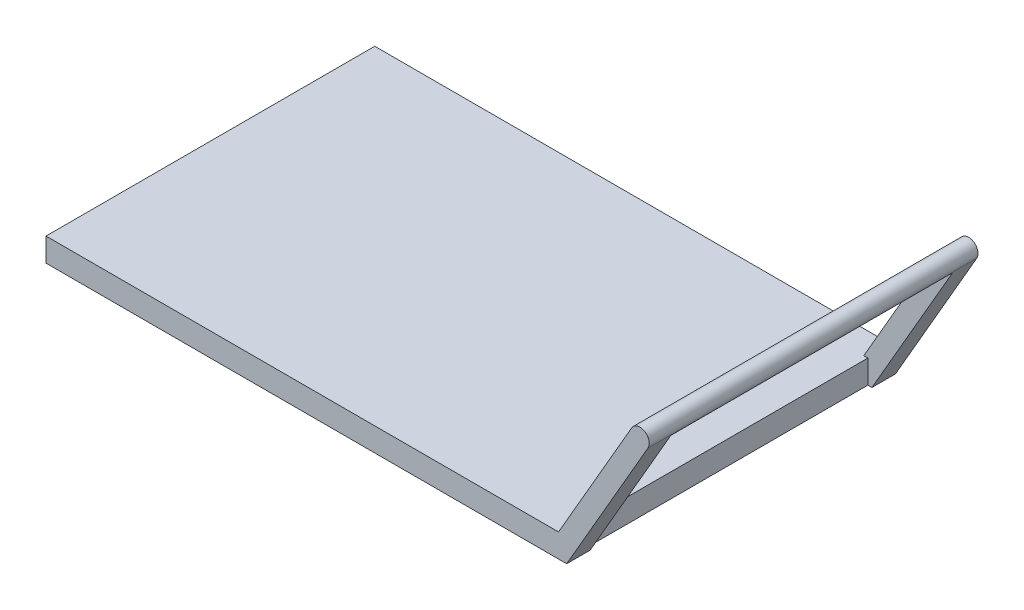
from build123d import *

# Parameters (mm, degrees)
SKETCH1_W           = 110
SKETCH1_H           = 70
BOSS_EXTRUDE1_DEPTH = 5
BOSS_EXTRUDE2_DEPTH = 5
BOSS_EXTRUDE3_DEPTH = 5
BOSS_EXTRUDE4_START = -70
SKETCH4_R           = 2
BOSS_EXTRUDE4_DEPTH = 70


with BuildPart() as part:
    # Sketch1 → Boss-Extrude1 (new body)
    with BuildSketch(Plane(origin=(0, 0, 0), x_dir=(1, 0, 0), z_dir=(0, 1, 0))):
        Rectangle(SKETCH1_W, SKETCH1_H)
    extrude(amount=BOSS_EXTRUDE1_DEPTH)

    # Sketch2 → Boss-Extrude2 (add)
    with BuildSketch(Plane.XY.offset(35)):
        Polygon((69.722431864, 32), (73.186533479, 30), (55.866025404, 0), (55, 0), (55, 5), (54.133974596, 5), align=None)
    extrude(amount=-BOSS_EXTRUDE2_DEPTH)

    # Sketch3 → Boss-Extrude3 (add)
    with BuildSketch(Plane(origin=(0, 0, -35), x_dir=(-1, 0, 0), z_dir=(0, 0, -1))):
        Polygon((-54.133974596, 5), (-69.722431864, 32), (-73.186533479, 30), (-55.866025404, 0), (-55, 0), (-55, 5), align=None)
    extrude(amount=-BOSS_EXTRUDE3_DEPTH)

    # Sketch4 → Boss-Extrude4 (add)
    with BuildSketch(Plane.XY.offset(35).offset(BOSS_EXTRUDE4_START)):
        with Locations(Location((71.454482672, 31, 0), (0, 0, 330))):
            Circle(SKETCH4_R)
    extrude(amount=BOSS_EXTRUDE4_DEPTH)


solid = part.part
